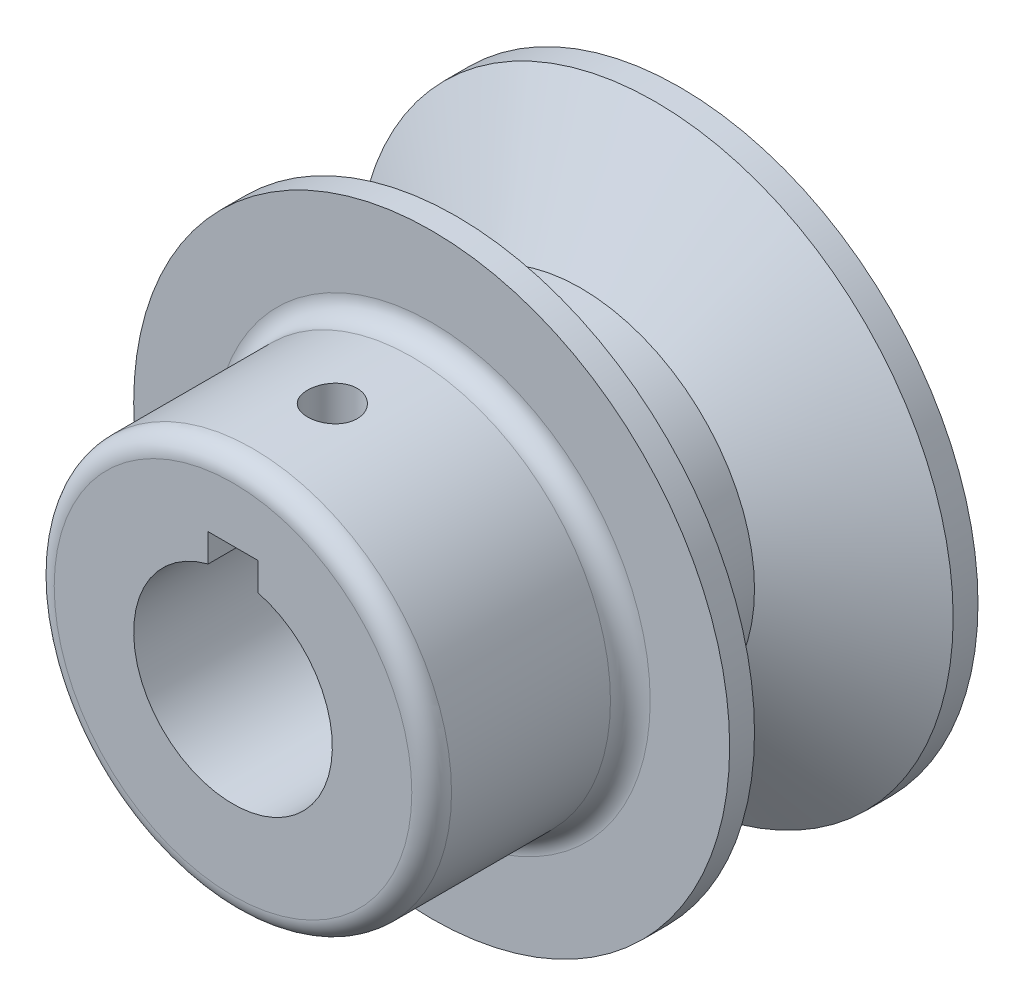
from build123d import *

# Parameters (mm, degrees)
SKETCH4_W          = 3.175
SKETCH4_H          = 3.175
CUT_EXTRUDE2_DEPTH = 40.272581084
SKETCH5_R          = 1.5875
CUT_EXTRUDE3_DEPTH = 40.272581084
FILLET1_R          = 1.27


with BuildPart() as part:
    # Sketch3 → Revolve2 (revolve)
    with BuildSketch(Plane(origin=(0, 0, 0), x_dir=(0, 0, -1), z_dir=(1, 0, 0)), mode=Mode.PRIVATE) as revolve2_sk:
        Polygon((0, 6.35), (28.575, 6.35), (28.575, 19.05), (26.9875, 19.05), (22.225, 11.1125), (19.05, 11.1125), (14.2875, 19.05), (12.7, 19.05), (12.7, 12.7), (0, 12.7), align=None)
    revolve(revolve2_sk.sketch.rotate(Axis((0, 0, 0), (0, 0, -1)), 90), axis=Axis((0, 0, 0), (0, 0, -1)))

    # Sketch4 → Cut-Extrude2 (cut, through all)
    with BuildSketch(Plane.XY):
        with Locations((0, 6.35)):
            Rectangle(SKETCH4_W, SKETCH4_H)
    extrude(amount=-CUT_EXTRUDE2_DEPTH, mode=Mode.SUBTRACT)

    # Sketch5 → Cut-Extrude3 (cut, through all)
    with BuildSketch(Plane(origin=(0, 0, 0), x_dir=(1, 0, 0), z_dir=(0, 1, 0))):
        with Locations(Location((0, 6.35, 0), (0, 0, 90))):
            Circle(SKETCH5_R)
    extrude(amount=CUT_EXTRUDE3_DEPTH, mode=Mode.SUBTRACT)

    # Fillet1
    fillet1_edges = [part.edges().sort_by_distance(p)[0] for p in [
        (-12.7, 0, -12.7),
        (-12.7, 0, 0),
    ]]
    fillet(fillet1_edges, radius=FILLET1_R)


solid = part.part
